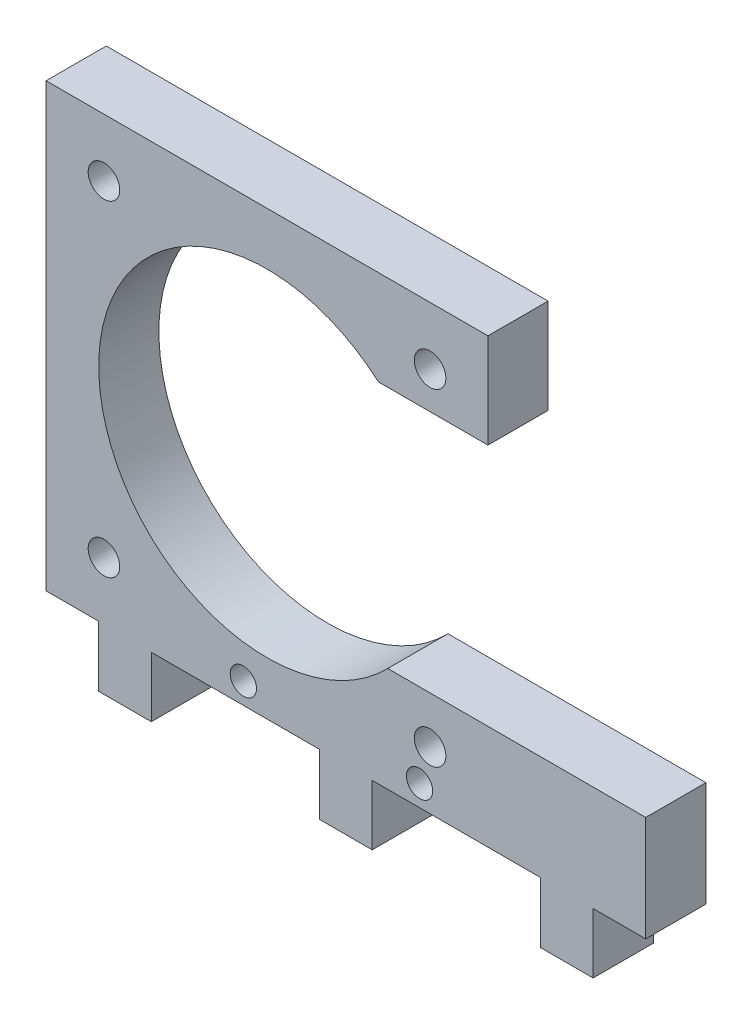
from build123d import *

# Parameters (mm, degrees)
SKETCH1_R           = 1.25
SKETCH1_R_2         = 1.5
BOSS_EXTRUDE1_DEPTH = 5.72


with BuildPart() as part:
    # Sketch1 → Boss-Extrude1 (new body)
    with BuildSketch(Plane.XY):
        with BuildLine():
            Line((9.38, 23.147938931), (-1.036994756, 23.147938931))
            ThreePointArc((-1.036994756, 23.147938931), (-27.608078489, 10.53040656), (-0.142915981, 0))
            Line((-0.142915981, 0), (24.38, 0))
            Line((24.38, 0), (24.38, -10))
            Line((24.38, -10), (19.38, -10))
            Line((19.38, -10), (19.38, -15.72))
            Line((19.38, -15.72), (14.38, -15.72))
            Line((14.38, -15.72), (14.38, -9.950687023))
            Line((14.38, -9.950687023), (-1.62, -9.950687023))
            Line((-1.62, -9.950687023), (-1.62, -15.670687023))
            Line((-1.62, -15.670687023), (-6.62, -15.670687023))
            Line((-6.62, -15.670687023), (-6.62, -9.901374046))
            Line((-6.62, -9.901374046), (-22.62, -9.901374046))
            Line((-22.62, -9.901374046), (-22.62, -15.621374046))
            Line((-22.62, -15.621374046), (-27.62, -15.621374046))
            Line((-27.62, -15.621374046), (-27.62, -9.852061069))
            Line((-27.62, -9.852061069), (-32.62, -9.852061069))
            Line((-32.62, -9.852061069), (-32.62, 32.147938931))
            Line((-32.62, 32.147938931), (9.38, 32.147938931))
            Line((9.38, 32.147938931), (9.38, 23.147938931))
        make_face()
        with Locations((2.88, -7.950687023)):
            Circle(SKETCH1_R, mode=Mode.SUBTRACT)
        with Locations((-13.87, -7.901374046)):
            Circle(SKETCH1_R, mode=Mode.SUBTRACT)
        with Locations((3.879843111, -4.450687023)):
            Circle(SKETCH1_R_2, mode=Mode.SUBTRACT)
        with Locations((-27.12, -4.352061069)):
            Circle(SKETCH1_R_2, mode=Mode.SUBTRACT)
        with Locations((-27.12, 26.647938931)):
            Circle(SKETCH1_R_2, mode=Mode.SUBTRACT)
        with Locations((3.88, 26.647938931)):
            Circle(SKETCH1_R_2, mode=Mode.SUBTRACT)
    extrude(amount=BOSS_EXTRUDE1_DEPTH)


solid = part.part
